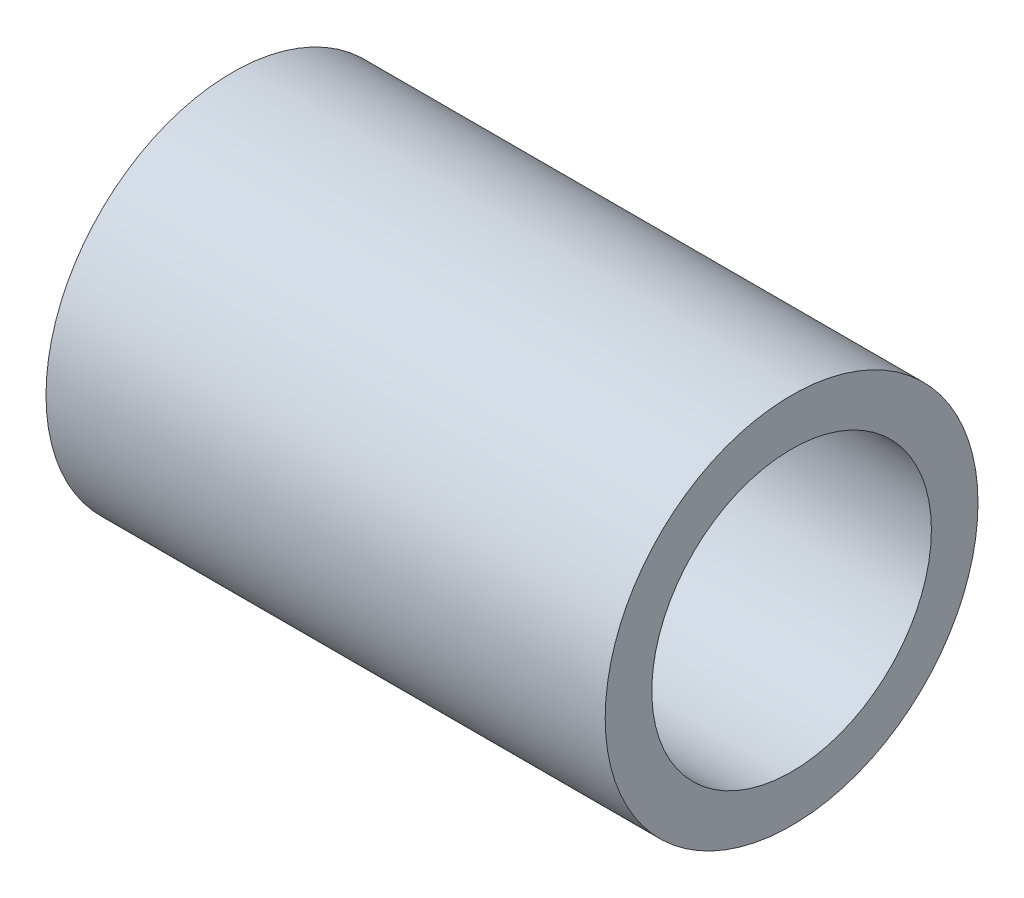
from build123d import *

# Parameters (mm, degrees)
SKETCH1_R           = 2
SKETCH1_R_2         = 1.5
BOSS_EXTRUDE1_DEPTH = 6


with BuildPart() as part:
    # Sketch1 → Boss-Extrude1 (new body)
    with BuildSketch(Plane(origin=(0, 0, 0), x_dir=(0, 0, -1), z_dir=(1, 0, 0))):
        Circle(SKETCH1_R)
        Circle(SKETCH1_R_2, mode=Mode.SUBTRACT)
    extrude(amount=BOSS_EXTRUDE1_DEPTH)


solid = part.part
